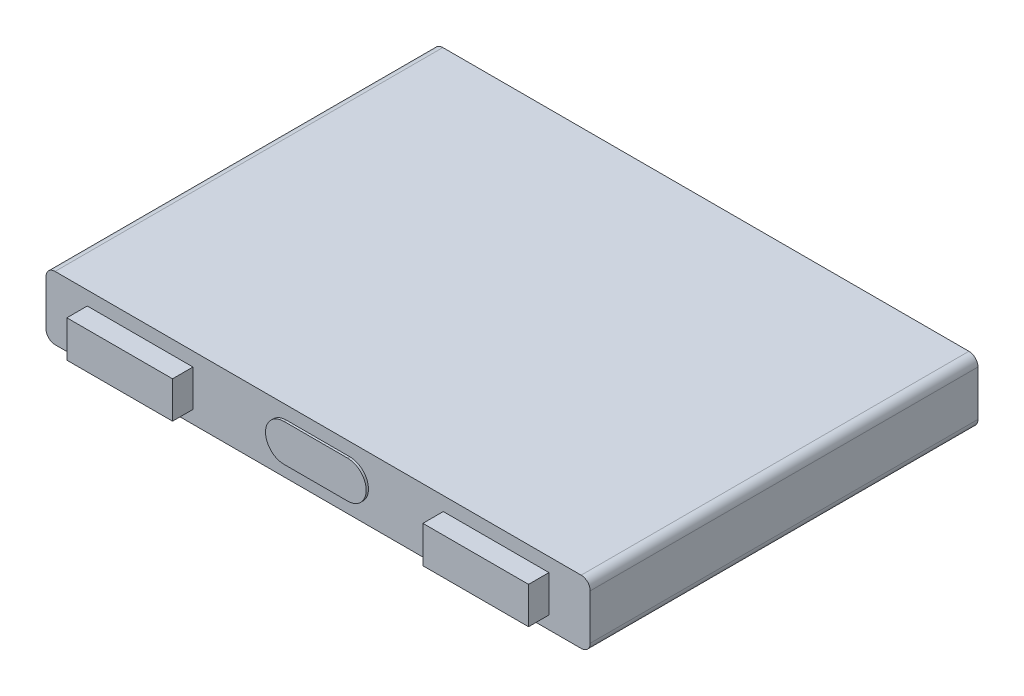
from build123d import *

# Parameters (mm, degrees)
SKETCH1_W           = 120
SKETCH1_H           = 85.5
BOSS_EXTRUDE1_DEPTH = 14
SKETCH2_W           = 23.3
SKETCH2_H           = 8.1
BOSS_EXTRUDE2_DEPTH = 4.5
FILLET2_R           = 2
BOSS_EXTRUDE3_DEPTH = 0.5


with BuildPart() as part:
    # Sketch1 → Boss-Extrude1 (new body)
    with BuildSketch(Plane(origin=(0, 0, 0), x_dir=(1, 0, 0), z_dir=(0, 1, 0))):
        Rectangle(SKETCH1_W, SKETCH1_H)
    extrude(amount=BOSS_EXTRUDE1_DEPTH)

    # Sketch2 → Boss-Extrude2 (add)
    with BuildSketch(Plane.XY.offset(42.75)):
        with Locations((-39.25, 6.894561701)):
            Rectangle(SKETCH2_W, SKETCH2_H)
        with Locations((39.25, 6.894561701)):
            Rectangle(SKETCH2_W, SKETCH2_H)
    extrude(amount=BOSS_EXTRUDE2_DEPTH)

    # Fillet2
    fillet2_edges = [part.edges().sort_by_distance(p)[0] for p in [
        (-60, 14, 0),
        (60, 14, 0),
        (-60, 0, 0),
        (60, 0, 0),
    ]]
    fillet(fillet2_edges, radius=FILLET2_R)

    # Sketch4 → Boss-Extrude3 (add)
    with BuildSketch(Plane.XY.offset(42.75)):
        with BuildLine():
            Line((-7, 2.9), (7, 2.9))
            ThreePointArc((7, 2.9), (11.1, 7), (7, 11.1))
            Line((7, 11.1), (-7, 11.1))
            ThreePointArc((-7, 11.1), (-11.1, 7), (-7, 2.9))
        make_face()
    extrude(amount=BOSS_EXTRUDE3_DEPTH)


solid = part.part
